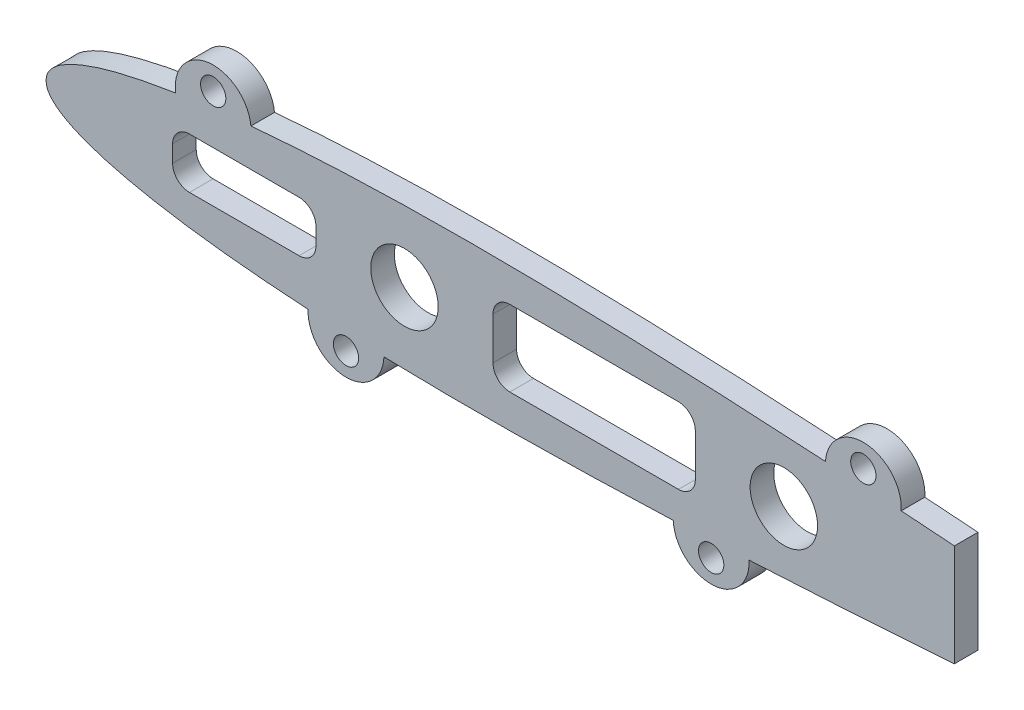
from build123d import *

# Parameters (mm, degrees)
SKETCH_1_R      = 1.5
SKETCH_1_R_2    = 4
EXTRUDE_1_DEPTH = 1.4


with BuildPart() as part:
    # Эскиз1 → Бобышка-Вытянуть1 (new, symmetric)
    with BuildSketch(Plane.XY):
        with BuildLine():
            Line((217.747634119, 0), (217.747634119, 6.058113078))
            add(Edge.make_bspline(
                [(217.747634119, 6.058113078), (217.243808474, 6.094887376), (215.140700226, 6.247183834), (213.037224342, 6.394367799), (211.437469318, 6.503148402)],
                knots=[0.362605011, 0.362605011, 0.362605011, 0.362605011, 0.371392651, 0.399285533, 0.399285533, 0.399285533, 0.399285533], degree=3))
            ThreePointArc((211.437469318, 6.503148402), (207.235292618, 11.29077317), (202.455940343, 7.079190122))
            add(Edge.make_bspline(
                [(202.455940343, 7.079190122), (202.056002141, 7.103223291), (200.009450225, 7.225045801), (196.331634567, 7.433105337), (191.441311474, 7.684604439), (186.608700127, 7.906218293), (181.844626933, 8.095958493), (177.159453511, 8.251957682), (172.563150272, 8.372486564), (168.065295924, 8.455953662), (163.675147454, 8.5010027), (159.401643404, 8.506522967), (155.253439756, 8.471528808), (151.238917925, 8.395506076), (147.366223919, 8.277985977), (143.643266298, 8.118975561), (140.077743555, 7.918678943), (136.982380939, 7.699243614), (135.077259612, 7.537606821), (134.305602735, 7.467259257)],
                knots=[0.451472212, 0.451472212, 0.451472212, 0.451472212, 0.458441906, 0.487136113, 0.515551917, 0.543623846, 0.571289984, 0.59849081, 0.625169613, 0.651272029, 0.676746158, 0.701541791, 0.725611017, 0.748907835, 0.771387785, 0.793008139, 0.813728033, 0.833507815, 0.846986731, 0.846986731, 0.846986731, 0.846986731], degree=3))
            ThreePointArc((134.305602735, 7.467259257), (129.292776458, 11.467825954), (125.371042184, 6.393088379))
            add(Edge.make_bspline(
                [(125.371042184, 6.393088379), (125.182557358, 6.363796993), (124.168294515, 6.203402144), (122.397158974, 5.896120566), (120.133109351, 5.434797476), (118.081312133, 4.94256764), (116.247665798, 4.421392386), (114.63793972, 3.873060465), (113.256788366, 3.299309237), (112.109835924, 2.701306387), (111.196336341, 2.078555233), (110.530223642, 1.427069758), (110.085538218, 0.73423022), (110.027578176, 0.23672144), (110, 0)],
                knots=[0.899174702, 0.899174702, 0.899174702, 0.899174702, 0.902492782, 0.917037139, 0.930441054, 0.942679762, 0.953733567, 0.963589785, 0.972247019, 0.979722225, 0.986065145, 0.991385258, 0.995900989, 1, 1, 1, 1], degree=3))
            add(Edge.make_bspline(
                [(110, 0), (110.027578176, -0.236721441), (110.085538218, -0.734230221), (110.530223642, -1.427069759), (111.196336341, -2.078555234), (112.109835924, -2.701306388), (113.256788366, -3.299309238), (114.63793972, -3.873060466), (116.247665798, -4.421392387), (118.081312133, -4.942567641), (120.133109351, -5.434797477), (122.397158974, -5.896120567), (124.867245825, -6.324666078), (127.536961089, -6.718650341), (130.399721686, -7.076424311), (133.448762895, -7.396480569), (136.677139412, -7.677604542), (139.245643336, -7.859689995), (140.736851964, -7.951317752), (141.093175889, -7.972438296)],
                knots=[0, 0, 0, 0, 0.004099011, 0.008614742, 0.013934855, 0.020277775, 0.027752981, 0.036410215, 0.046266433, 0.057320238, 0.069558946, 0.082962861, 0.097507218, 0.113164082, 0.12990269, 0.147690304, 0.166492185, 0.186271967, 0.192481252, 0.192481252, 0.192481252, 0.192481252], degree=3))
            ThreePointArc((141.093175889, -7.972438296), (145.394805922, -12.695875937), (150.084655985, -8.35765159))
            add(Edge.make_bspline(
                [(150.084655985, -8.35765159), (150.453806444, -8.367988388), (152.161758649, -8.412981849), (155.253439756, -8.471528808), (159.401643404, -8.506522967), (163.675147454, -8.5010027), (168.065295924, -8.455953663), (172.563150272, -8.372486564), (177.159453511, -8.251957682), (181.117095872, -8.120182624), (183.541473355, -8.027281081), (184.403269889, -7.992794251)],
                knots=[0.244668107, 0.244668107, 0.244668107, 0.244668107, 0.251092165, 0.274388983, 0.298458209, 0.323253842, 0.348727971, 0.374830387, 0.40150919, 0.428710016, 0.443713425, 0.443713425, 0.443713425, 0.443713425], degree=3))
            ThreePointArc((184.403269889, -7.992794251), (189.104065456, -12.29533144), (193.393900024, -7.582940899))
            add(Edge.make_bspline(
                [(193.393900024, -7.582940899), (194.367821921, -7.533422186), (196.98891626, -7.395921928), (201.268368917, -7.153826886), (206.239642946, -6.848873), (211.232977593, -6.52047435), (215.071311266, -6.252208631), (217.243808474, -6.094887376), (217.747634119, -6.058113078)],
                knots=[0.495900102, 0.495900102, 0.495900102, 0.495900102, 0.512863887, 0.541558094, 0.570462313, 0.599504248, 0.628607349, 0.637394989, 0.637394989, 0.637394989, 0.637394989], degree=3))
            Line((217.747634119, -6.058113078), (217.747634119, 0))
        make_face()
        with Locations((145.587418391, -10)):
            Circle(SKETCH_1_R, mode=Mode.SUBTRACT)
        with Locations((188.899138034, -9.6)):
            Circle(SKETCH_1_R, mode=Mode.SUBTRACT)
        with BuildLine():
            Line((140.01848428, -3), (127.01848428, -3))
            ThreePointArc((127.01848428, -3), (125.604270718, -2.414213562), (125.01848428, -1))
            Line((125.01848428, -1), (125.01848428, 1))
            ThreePointArc((125.01848428, 1), (125.604270718, 2.414213562), (127.01848428, 3))
            Line((127.01848428, 3), (140.01848428, 3))
            ThreePointArc((140.01848428, 3), (141.432697843, 2.414213562), (142.01848428, 1))
            Line((142.01848428, 1), (142.01848428, -1))
            ThreePointArc((142.01848428, -1), (141.432697843, -2.414213562), (140.01848428, -3))
        make_face(mode=Mode.SUBTRACT)
        with Locations((152.51848428, 0)):
            Circle(SKETCH_1_R_2, mode=Mode.SUBTRACT)
        with BuildLine():
            Line((185.01848428, -4.5), (165.01848428, -4.5))
            ThreePointArc((165.01848428, -4.5), (163.604270718, -3.914213562), (163.01848428, -2.5))
            Line((163.01848428, -2.5), (163.01848428, 2.5))
            ThreePointArc((163.01848428, 2.5), (163.604270718, 3.914213562), (165.01848428, 4.5))
            Line((165.01848428, 4.5), (185.01848428, 4.5))
            ThreePointArc((185.01848428, 4.5), (186.432697843, 3.914213562), (187.01848428, 2.5))
            Line((187.01848428, 2.5), (187.01848428, -2.5))
            ThreePointArc((187.01848428, -2.5), (186.432697843, -3.914213562), (185.01848428, -4.5))
        make_face(mode=Mode.SUBTRACT)
        with Locations((129.829927502, 8.8)):
            Circle(SKETCH_1_R, mode=Mode.SUBTRACT)
        with Locations((197.51848428, 0)):
            Circle(SKETCH_1_R_2, mode=Mode.SUBTRACT)
        with Locations((206.947271201, 8.6)):
            Circle(SKETCH_1_R, mode=Mode.SUBTRACT)
    extrude(amount=EXTRUDE_1_DEPTH, both=True)


solid = part.part
